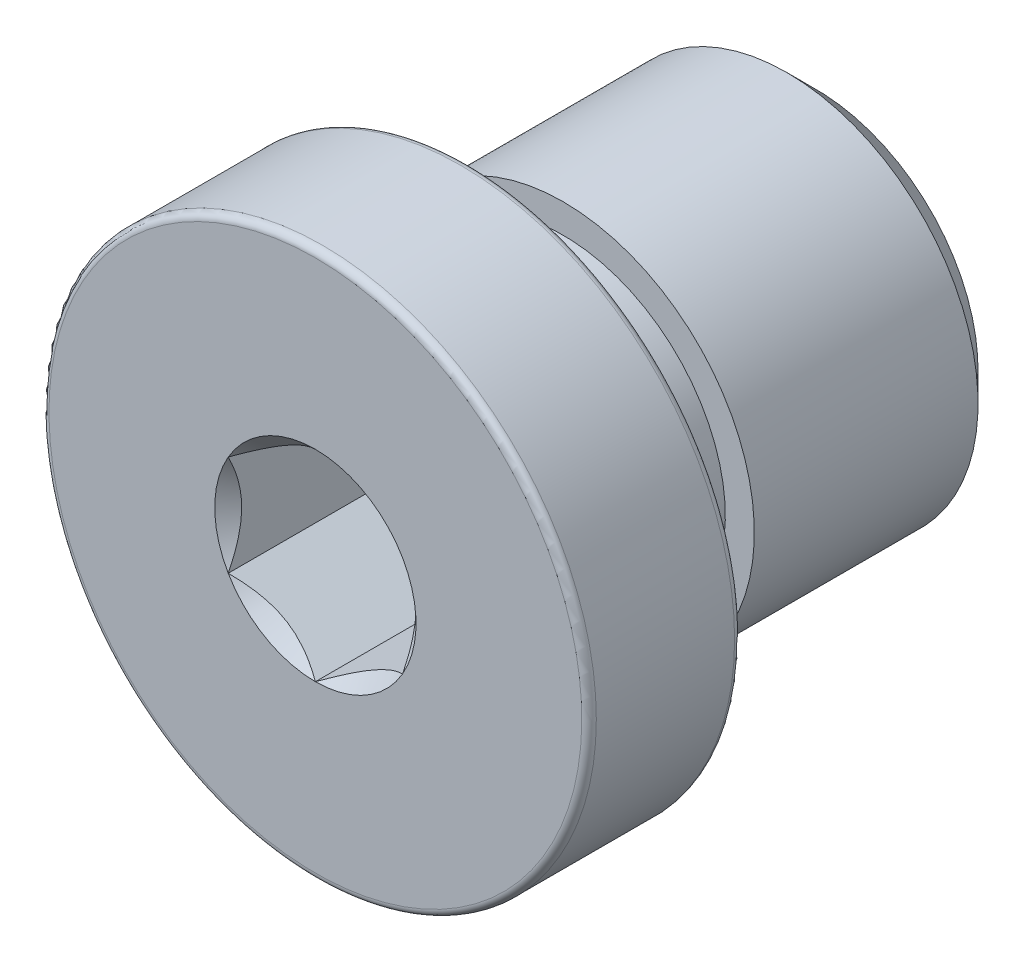
from build123d import *

# Parameters (mm, degrees)
EXTRUDE1_DEPTH = 8
FILLET1_R      = 0.25
SKETCH4_R      = 7.745
SKETCH4_R_2    = 6.545
EXTRUDE3_DEPTH = 1.5


with BuildPart() as part:
    # Sketch1 → Revolve1 (revolve)
    with BuildSketch(Plane(origin=(0, 0, 0), x_dir=(0, 0, -1), z_dir=(1, 0, 0)), mode=Mode.PRIVATE) as revolve1_sk:
        Polygon((0, 0), (0, 9.42), (5.26, 9.42), (5.26, 7.745), (4.26, 7.745), (4.26, 5.58), (8.53, 5.58), (8.53, 6.5785), (16.23, 6.5785), (17.23, 5.5785), (17.23, 0), align=None)
    revolve(revolve1_sk.sketch.rotate(Axis((0, 0, 0), (0, 0, -1)), 180), axis=Axis((0, 0, 0), (0, 0, -1)))

    # Sketch2 → Extrude1 (cut)
    with BuildSketch(Plane.XY):
        Polygon((0, 3.464101615), (-3, 1.732050808), (-3, -1.732050808), (0, -3.464101615), (3, -1.732050808), (3, 1.732050808), align=None)
    extrude(amount=-EXTRUDE1_DEPTH, mode=Mode.SUBTRACT)

    # Fillet1
    fillet1_edges = [part.edges().sort_by_distance(p)[0] for p in [
        (0, 9.42, -5.26),
        (0, 9.42, 0),
    ]]
    fillet(fillet1_edges, radius=FILLET1_R)

    # Sketch4 → Extrude3 (add)
    with BuildSketch(Plane(origin=(0, 0, -4.26), x_dir=(-1, 0, 0), z_dir=(0, 0, -1))):
        with Locations(Location((0, 0, 0), (0, 0, 270))):
            Circle(SKETCH4_R)
        with Locations(Location((0, 0, 0), (0, 0, 90))):
            Circle(SKETCH4_R_2, mode=Mode.SUBTRACT)
    extrude(amount=EXTRUDE3_DEPTH)

    # Sketch5 → Cut-Revolve1 (revolve, cut)
    with BuildSketch(Plane(origin=(0, 0, 0), x_dir=(0, 0, -1), z_dir=(1, 0, 0))):
        Polygon((0, 3.464101615), (0.8, 2.664101615), (0.8, 0), (0, 0), align=None)
    revolve(axis=Axis((0, 0, 0), (0, 0, -1)), mode=Mode.SUBTRACT)


solid = part.part
